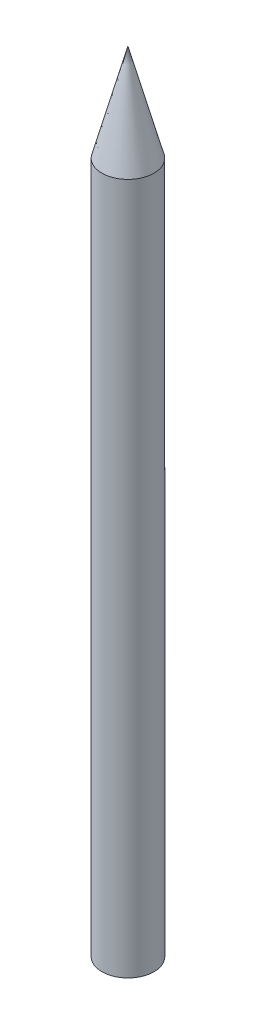
from build123d import *


with BuildPart() as part:
    # Sketch1 → Revolve1 (revolve)
    with BuildSketch(Plane(origin=(0, 0, 0), x_dir=(0, 0, -1), z_dir=(1, 0, 0))):
        Polygon((0, 0), (0, -10), (0.33, -10), (0.33, -1.231576766), align=None)
    revolve(axis=Axis((0, 0, 0), (0, -1, 0)))


solid = part.part
